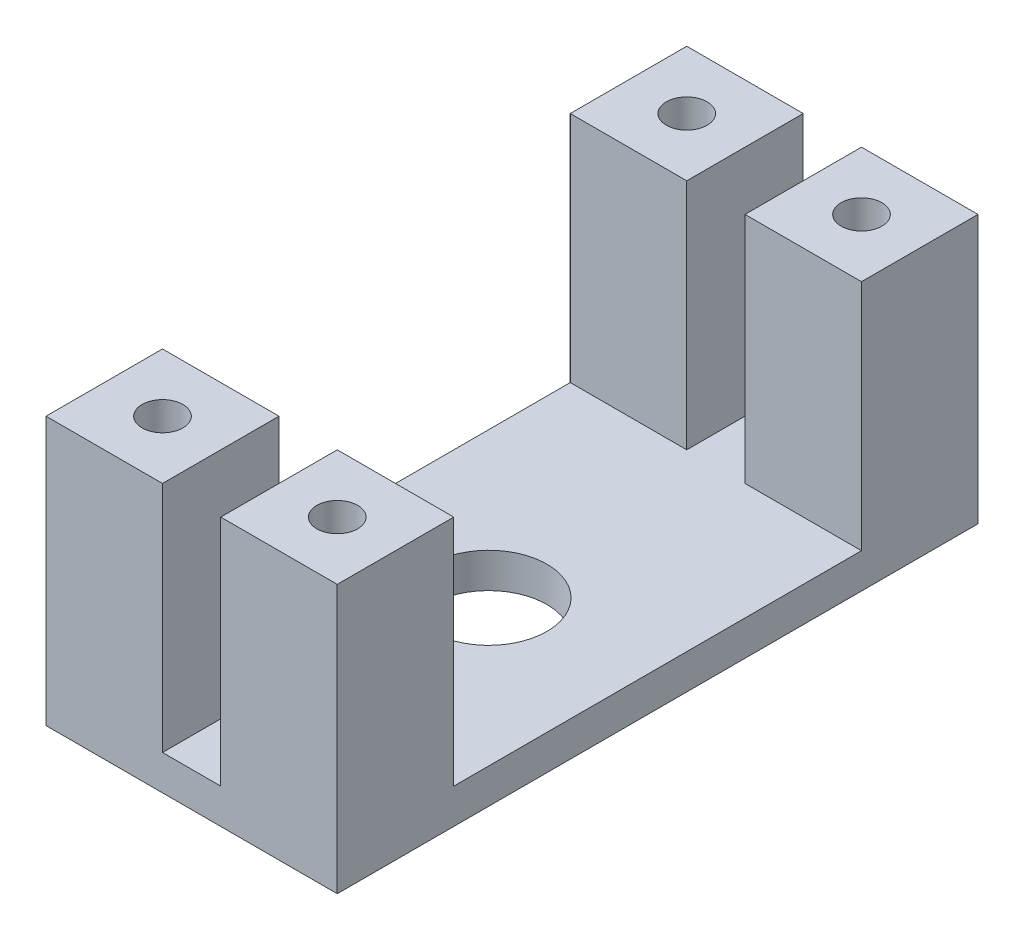
from build123d import *

# Parameters (mm, degrees)
SKETCH_1_W               = 25
SKETCH_1_H               = 55
EXTRUDE_1_DEPTH          = 3
SKETCH_7_W               = 10
SKETCH_7_H               = 10
EXTRUDE_2_DEPTH          = 20
HOLE_WIZARD_2_D          = 10
SKETCH_4_W               = 1.75
SKETCH_4_H               = 3
HOLE_WIZARD_1_AT_2_COUNT = 2
HOLE_WIZARD_1_AT_2_PITCH = 15
HOLE_WIZARD_1_AT_3_COUNT = 2
HOLE_WIZARD_1_AT_3_PITCH = 47.434164903
HOLE_WIZARD_1_AT_4_COUNT = 2
HOLE_WIZARD_1_AT_4_PITCH = 45
HOLE_WIZARD_3_D          = 3.5


with BuildPart() as part:
    # 草图1 → 凸台-拉伸1 (new body)
    with BuildSketch(Plane(origin=(0, 0, 0), x_dir=(1, 0, 0), z_dir=(0, 1, 0))):
        Rectangle(SKETCH_1_W, SKETCH_1_H)
    extrude(amount=EXTRUDE_1_DEPTH)

    # 草图7 → 凸台-拉伸2 (add)
    with BuildSketch(Plane(origin=(0, 3, 0), x_dir=(1, 0, 0), z_dir=(0, 1, 0))):
        with Locations((-7.5, 22.5)):
            Rectangle(SKETCH_7_W, SKETCH_7_H)
        with Locations((7.5, 22.5)):
            Rectangle(SKETCH_7_W, SKETCH_7_H)
        with Locations((7.5, -22.5)):
            Rectangle(SKETCH_7_W, SKETCH_7_H)
        with Locations((-7.5, -22.5)):
            Rectangle(SKETCH_7_W, SKETCH_7_H)
    extrude(amount=EXTRUDE_2_DEPTH)

    # 孔2 (through all)
    with Locations(Plane(origin=(0, 3, 0), x_dir=(1, 0, 0), z_dir=(0, 1, 0))):
        with Locations((0, -2)):
            Hole(HOLE_WIZARD_2_D / 2)

    # 草图4 → 孔1 (revolve, cut)
    with BuildSketch(Plane(origin=(-7.5, 3, -22.5), x_dir=(0, 0, 1), z_dir=(1, 0, 0))):
        with Locations((0.875, 1.5)):
            Rectangle(SKETCH_4_W, SKETCH_4_H)
    hole_wizard_1 = revolve(axis=Axis((-7.5, -107, -22.5), (0, 1, 0)), mode=Mode.SUBTRACT)

    # 孔1 at 2: 孔1 ×2
    with Locations(*[(i * HOLE_WIZARD_1_AT_2_PITCH, 0, 0) for i in range(1, HOLE_WIZARD_1_AT_2_COUNT)]):
        add(hole_wizard_1, mode=Mode.SUBTRACT)

    # 孔1 at 3: 孔1 ×2
    with Locations(*[Vector(0.3162277660168381, 0, 0.9486832980505139) * (i * HOLE_WIZARD_1_AT_3_PITCH) for i in range(1, HOLE_WIZARD_1_AT_3_COUNT)]):
        add(hole_wizard_1, mode=Mode.SUBTRACT)

    # 孔1 at 4: 孔1 ×2
    with Locations(*[(0, 0, i * HOLE_WIZARD_1_AT_4_PITCH) for i in range(1, HOLE_WIZARD_1_AT_4_COUNT)]):
        add(hole_wizard_1, mode=Mode.SUBTRACT)

    # 孔3 (through all)
    with Locations(Plane(origin=(0, 0, 0), x_dir=(-1, 0, 0), z_dir=(0, -1, 0))):
        with Locations((7.5, 22.5), (-7.5, 22.5), (-7.5, -22.5), (7.5, -22.5)):
            Hole(HOLE_WIZARD_3_D / 2)


solid = part.part
